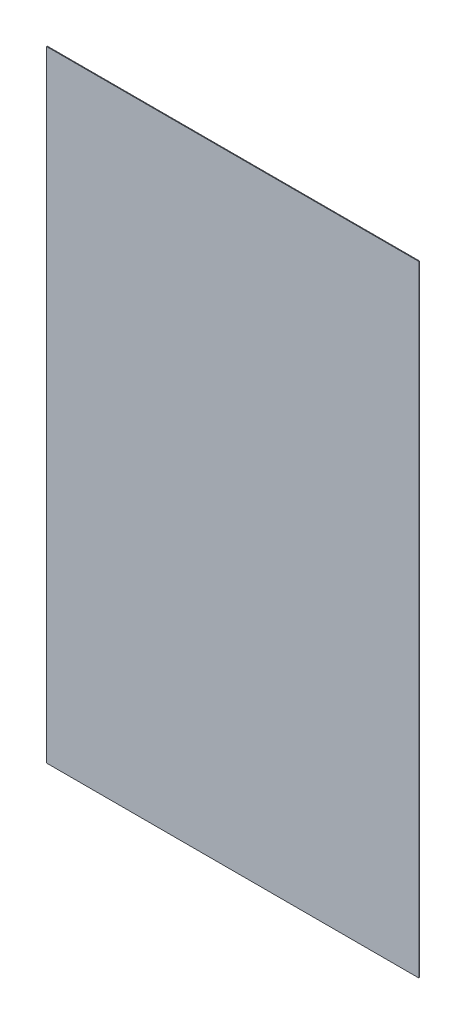
from build123d import *

# Parameters (mm, degrees)
SKETCH_1_W      = 1500
SKETCH_1_H      = 2500
EXTRUDE_1_DEPTH = 3


with BuildPart() as part:
    # 草圖1 → 填料-伸長1 (new body)
    with BuildSketch(Plane.XY):
        with Locations((750, -1250)):
            Rectangle(SKETCH_1_W, SKETCH_1_H)
    extrude(amount=EXTRUDE_1_DEPTH)


solid = part.part
